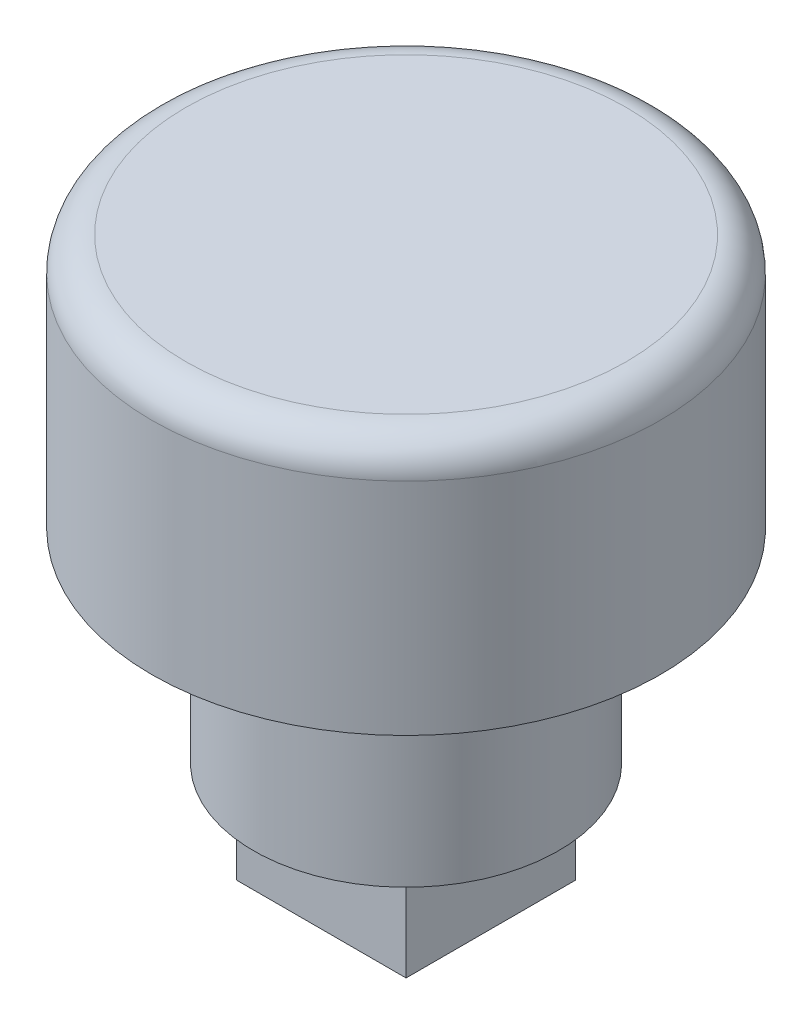
from build123d import *

# Parameters (mm, degrees)
SKETCH1_R           = 7.5
BOSS_EXTRUDE1_DEPTH = 7.5
FILLET1_R           = 1
SKETCH2_R           = 4.5
BOSS_EXTRUDE2_DEPTH = 6
SKETCH3_W           = 5
SKETCH3_H           = 5
BOSS_EXTRUDE3_DEPTH = 3


with BuildPart() as part:
    # Sketch1 → Boss-Extrude1 (new body)
    with BuildSketch(Plane(origin=(0, 0, 0), x_dir=(1, 0, 0), z_dir=(0, 1, 0))):
        with Locations(Location((0, 0, 0), (0, 0, 270))):
            Circle(SKETCH1_R)
    extrude(amount=BOSS_EXTRUDE1_DEPTH)

    # Fillet1
    fillet1_edges = [part.edges().sort_by_distance(p)[0] for p in [
        (0, 7.5, -7.5),
    ]]
    fillet(fillet1_edges, radius=FILLET1_R)

    # Sketch2 → Boss-Extrude2 (add)
    with BuildSketch(Plane(origin=(0, 0, 0), x_dir=(-1, 0, 0), z_dir=(0, -1, 0))):
        with Locations(Location((0, 0, 0), (0, 0, 90))):
            Circle(SKETCH2_R)
    extrude(amount=BOSS_EXTRUDE2_DEPTH)

    # Sketch3 → Boss-Extrude3 (add)
    with BuildSketch(Plane(origin=(0, -6, 0), x_dir=(-1, 0, 0), z_dir=(0, -1, 0))):
        Rectangle(SKETCH3_W, SKETCH3_H)
    extrude(amount=BOSS_EXTRUDE3_DEPTH)


solid = part.part
